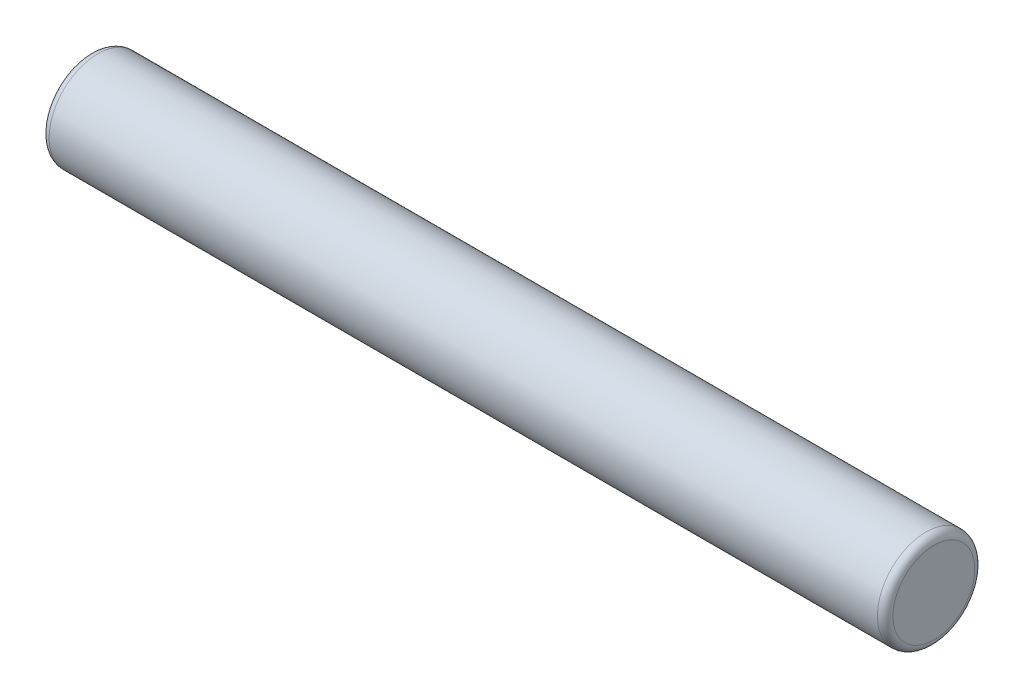
from build123d import *

# Parameters (mm, degrees)
SKETCH1_R           = 6.35
BOSS_EXTRUDE1_DEPTH = 110
FILLET1_R           = 1.016


with BuildPart() as part:
    # Sketch1 → Boss-Extrude1 (new body)
    with BuildSketch(Plane(origin=(0, 0, 0), x_dir=(0, 0, -1), z_dir=(1, 0, 0))):
        Circle(SKETCH1_R)
    extrude(amount=BOSS_EXTRUDE1_DEPTH)

    # Fillet1
    fillet1_edges = [part.edges().sort_by_distance(p)[0] for p in [
        (0, 0, 6.35),
        (110, 0, 6.35),
    ]]
    fillet(fillet1_edges, radius=FILLET1_R)


solid = part.part
